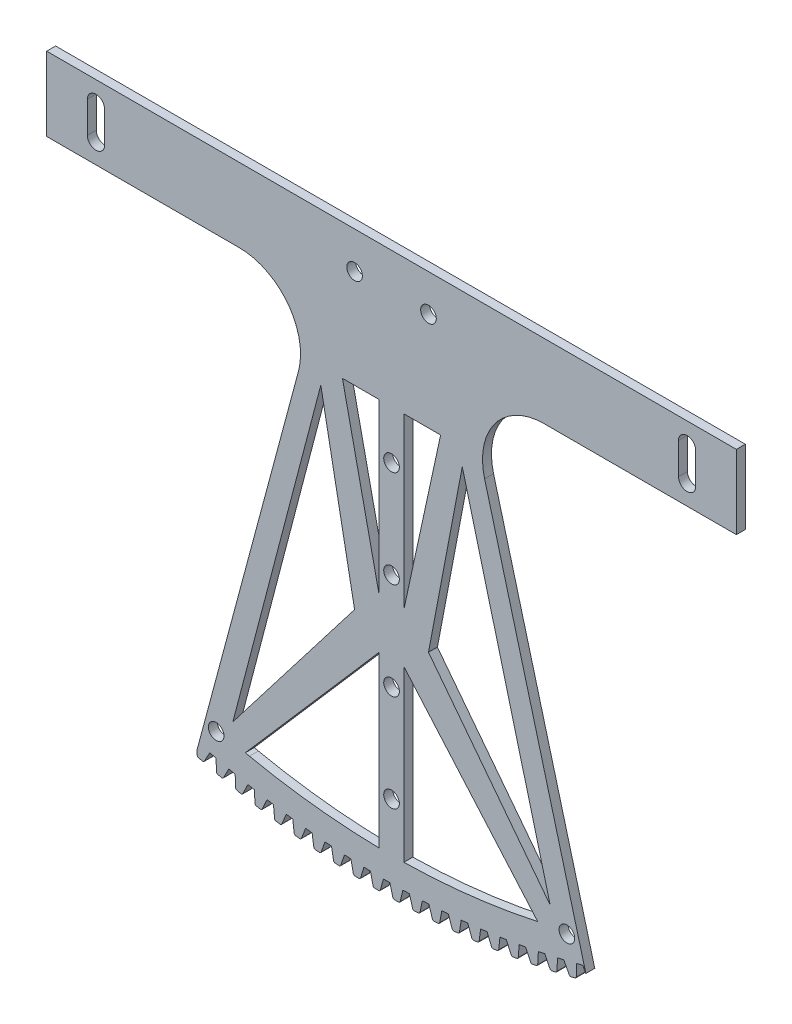
from build123d import *

# Parameters (mm, degrees)
BOSS_EXTRUDE2_DEPTH      = 3.628571429
FILLET1_R                = 25
BOSS_EXTRUDE4_DEPTH      = 3.628571429
CUT_EXTRUDE2_DEPTH       = 336.434355024
FILLET2_R                = 0.7
CIRPATTERN8_COUNT        = 20
CIRPATTERN8_ANGLE        = 28.5
FILLET2_OF_CIRPATTERN8_R = 0.7
SKETCH5_R                = 3.175
CUT_EXTRUDE3_DEPTH       = 338.740173511
SKETCH17_R               = 3.175
CUT_EXTRUDE4_DEPTH       = 338.740173511


with BuildPart() as part:
    # Sketch3 → Boss-Extrude2 (new body)
    with BuildSketch(Plane.XY):
        with BuildLine():
            Line((-140, -79.56), (-140, -109.56))
            Line((-140, -109.56), (-29.356513523, -109.56))
            Line((-29.356513523, -109.56), (-78.888044947, -294.414191853))
            ThreePointArc((-78.888044947, -294.414191853), (0, -304.8), (78.888044947, -294.414191853))
            Line((78.888044947, -294.414191853), (29.356513523, -109.56))
            Line((29.356513523, -109.56), (140, -109.56))
            Line((140, -109.56), (140, -79.56))
            Line((140, -79.56), (-140, -79.56))
        make_face()
    extrude(amount=BOSS_EXTRUDE2_DEPTH)

    # Fillet1
    fillet1_edges = [part.edges().sort_by_distance(p)[0] for p in [
        (29.356513523, -109.56, 1.814285714),
        (-29.356513523, -109.56, 1.814285714),
    ]]
    fillet(fillet1_edges, radius=FILLET1_R)

    # Sketch14 → Boss-Extrude4 (add)
    with BuildSketch(Plane(origin=(0, 0, 0), x_dir=(-1, 0, 0), z_dir=(0, 0, -1))):
        with BuildLine():
            Line((78.910933272, -297.036934084), (78.888044947, -294.414191853))
            ThreePointArc((78.888044947, -294.414191853), (76.959432674, -294.924203351), (75.027523715, -295.421581279))
            Line((75.027523715, -295.421581279), (76.289081309, -297.721097125))
            Line((76.289081309, -297.721097125), (78.910933272, -297.036934084))
        make_face()
    boss_extrude4 = extrude(amount=-BOSS_EXTRUDE4_DEPTH)

    # Sketch16 → Cut-Extrude2 (cut, symmetric)
    with BuildSketch(Plane(origin=(0, 0, 0), x_dir=(-1, 0, 0), z_dir=(0, 0, -1))):
        Polygon((372.937709596, -838.440145613), (75.027523715, -295.421581279), (73.765262731, -293.12078332), (71.19993834, -293.754449124), (71.154137831, -296.378353915), (60.344615656, -915.654378233), (357.400151379, -2118.250141136), (669.993245319, -2041.035908516), align=None)
    cut_extrude2 = extrude(amount=CUT_EXTRUDE2_DEPTH, both=True, mode=Mode.SUBTRACT)

    # Fillet2
    fillet2_edges = [part.edges().sort_by_distance(p)[0] for p in [
        (-76.289081309, -297.721097125, 1.814285714),
        (-78.910933272, -297.036934084, 1.814285714),
    ]]
    fillet(fillet2_edges, radius=FILLET2_R)

    # CirPattern8: Boss-Extrude4, Cut-Extrude2 ×20 about axis
    cirpattern8_axis = Axis((0, 0, 0), (0, 0, 1))
    add([boss_extrude4.rotate(cirpattern8_axis, i * CIRPATTERN8_ANGLE / (CIRPATTERN8_COUNT - 1)) for i in range(1, CIRPATTERN8_COUNT)])
    add([cut_extrude2.rotate(cirpattern8_axis, i * CIRPATTERN8_ANGLE / (CIRPATTERN8_COUNT - 1)) for i in range(1, CIRPATTERN8_COUNT)], mode=Mode.SUBTRACT)

    # Fillet2 of CirPattern8
    fillet2_of_cirpattern8_edges = [part.edges().sort_by_distance(p)[0] for p in [
        (-68.469509176, -299.616090878, 1.814285714),
        (-71.108371997, -299.000794367, 1.814285714),
        (-60.603011462, -301.305742729, 1.814285714),
        (-63.257076596, -300.75973444, 1.814285714),
        (-52.694979472, -302.788894675, 1.814285714),
        (-55.362427954, -302.312548815, 1.814285714),
        (-44.750832974, -304.064530237, 1.814285714),
        (-47.429836669, -303.65817327, 1.814285714),
        (-36.776016491, -305.131775158, 1.814285714),
        (-39.464739344, -304.795685581, 1.814285714),
        (-28.775995563, -305.989898002, 1.814285714),
        (-31.472594858, -305.724306153, 1.814285714),
        (-20.756253006, -306.638310655, 1.814285714),
        (-23.458880627, -306.443398558, 1.814285714),
        (-12.722285149, -307.076568726, 1.814285714),
        (-15.429088851, -306.952469964, 1.814285714),
        (-4.679598073, -307.304371856, 1.814285714),
        (-7.388722748, -307.251171481, 1.814285714),
        (3.366296165, -307.32156392, 1.814285714),
        (0.656707216, -307.339298391, 1.814285714),
        (11.409883312, -307.128133135, 1.814285714),
        (8.701687106, -307.216790299, 1.814285714),
        (19.445650695, -306.724212069, 1.814285714),
        (16.740703294, -306.883731164, 1.814285714),
        (27.468091, -306.110077549, 1.814285714),
        (24.76824624, -306.340349249, 1.814285714),
        (35.471706048, -305.286150472, 1.814285714),
        (32.778814268, -305.587016961, 1.814285714),
        (43.45101056, -304.252995517, 1.814285714),
        (40.766917333, -304.624250596, 1.814285714),
        (51.40053592, -303.011320757, 1.814285714),
        (48.72708079, -303.452709986, 1.814285714),
        (59.31483392, -301.561977174, 1.814285714),
        (56.65384914, -302.073198046, 1.814285714),
        (67.188480496, -299.905958075, 1.814285714),
        (64.541789771, -300.486660225, 1.814285714),
        (75.016079444, -298.044398412, 1.814285714),
        (72.385496683, -298.694183857, 1.814285714),
    ]]
    fillet(fillet2_of_cirpattern8_edges, radius=FILLET2_OF_CIRPATTERN8_R)

    # Sketch5 → Cut-Extrude3 (cut, through all)
    with BuildSketch(Plane(origin=(0, 0, 0), x_dir=(-1, 0, 0), z_dir=(0, 0, -1))):
        with Locations((-15, -94.56)):
            Circle(SKETCH5_R)
        with Locations((15, -94.56)):
            Circle(SKETCH5_R)
        with BuildLine():
            Line((-123.5, -94.56), (-123.5, -100.91))
            ThreePointArc((-123.5, -100.91), (-120, -104.41), (-116.5, -100.91))
            Line((-116.5, -100.91), (-116.5, -94.56))
            Line((-116.5, -94.56), (-116.5, -88.21))
            ThreePointArc((-116.5, -88.21), (-120, -84.71), (-123.5, -88.21))
            Line((-123.5, -88.21), (-123.5, -94.56))
        make_face()
        with BuildLine():
            Line((116.5, -94.56), (116.5, -88.21))
            ThreePointArc((116.5, -88.21), (120, -84.71), (123.5, -88.21))
            Line((123.5, -88.21), (123.5, -94.56))
            Line((123.5, -94.56), (123.5, -100.91))
            ThreePointArc((123.5, -100.91), (120, -104.41), (116.5, -100.91))
            Line((116.5, -100.91), (116.5, -94.56))
        make_face()
    extrude(amount=-CUT_EXTRUDE3_DEPTH, mode=Mode.SUBTRACT)

    # Sketch17 → Cut-Extrude4 (cut, through all)
    with BuildSketch(Plane(origin=(0, 0, 0), x_dir=(-1, 0, 0), z_dir=(0, 0, -1))):
        Polygon((-28.711660115, -141.33134449), (-64.419853025, -277.589898046), (-15, -213.409642912), align=None)
        Polygon((15, -213.409642912), (64.419853025, -277.589898046), (28.711660115, -141.33134449), align=None)
        with BuildLine():
            Line((57.677925946, -286.294618468), (59.356743472, -285.913498464))
            Line((59.356743472, -285.913498464), (5, -223.409642912))
            Line((5, -223.409642912), (5, -292.259285824))
            ThreePointArc((5, -292.259285824), (31.480548191, -290.527384931), (57.677925946, -286.294618468))
        make_face()
        with BuildLine():
            Line((-5, -223.409642912), (-59.372890863, -285.932066063))
            ThreePointArc((-59.372890863, -285.932066063), (-32.341547535, -290.428544105), (-5, -292.259285824))
            Line((-5, -292.259285824), (-5, -223.409642912))
        make_face()
        Polygon((5, -203.409642912), (19.937147844, -134.56), (5, -134.56), align=None)
        Polygon((-19.937147844, -134.56), (-5, -203.409642912), (-5, -134.56), align=None)
        with Locations((0, -193.697232184)):
            Circle(SKETCH17_R)
        with Locations((0, -154.272410728)):
            Circle(SKETCH17_R)
        with Locations((0, -233.12205364)):
            Circle(SKETCH17_R)
        with Locations((0, -272.546875096)):
            Circle(SKETCH17_R)
        with Locations((71.194365296, -284.361242536)):
            Circle(SKETCH17_R)
        with Locations((-71.194365296, -284.361242536)):
            Circle(SKETCH17_R)
    extrude(amount=-CUT_EXTRUDE4_DEPTH, mode=Mode.SUBTRACT)


solid = part.part
